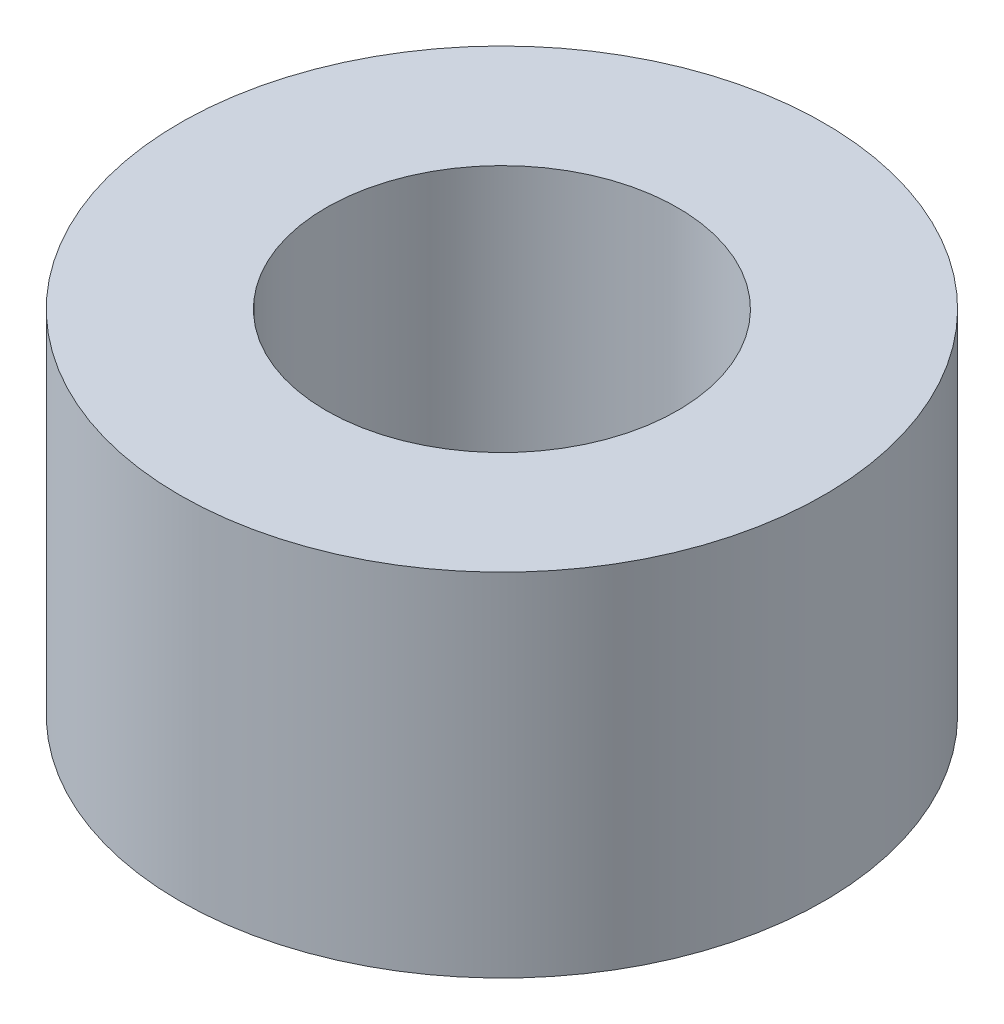
from build123d import *

# Parameters (mm, degrees)
SKETCH1_R           = 5.5
SKETCH1_R_2         = 3
BOSS_EXTRUDE1_DEPTH = 6


with BuildPart() as part:
    # Sketch1 → Boss-Extrude1 (new body)
    with BuildSketch(Plane(origin=(0, 0, 0), x_dir=(1, 0, 0), z_dir=(0, 1, 0))):
        with Locations(Location((0, 0, 0), (0, 0, 270))):
            Circle(SKETCH1_R)
        with Locations(Location((0, 0, 0), (0, 0, 270))):
            Circle(SKETCH1_R_2, mode=Mode.SUBTRACT)
    extrude(amount=BOSS_EXTRUDE1_DEPTH)


solid = part.part
